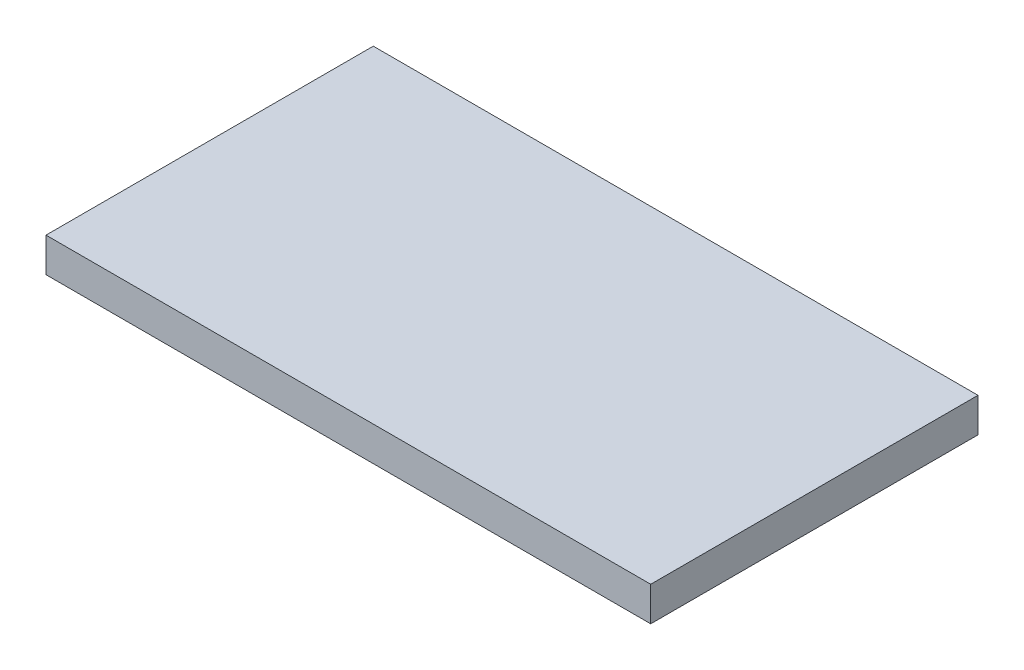
from build123d import *

# Parameters (mm, degrees)
SKETCH1_W           = 246.38
SKETCH1_H           = 133.35
BOSS_EXTRUDE1_DEPTH = 13.97


with BuildPart() as part:
    # Sketch1 → Boss-Extrude1 (new body)
    with BuildSketch(Plane(origin=(0, 0, 0), x_dir=(1, 0, 0), z_dir=(0, 1, 0))):
        Rectangle(SKETCH1_W, SKETCH1_H)
    extrude(amount=BOSS_EXTRUDE1_DEPTH)


solid = part.part
